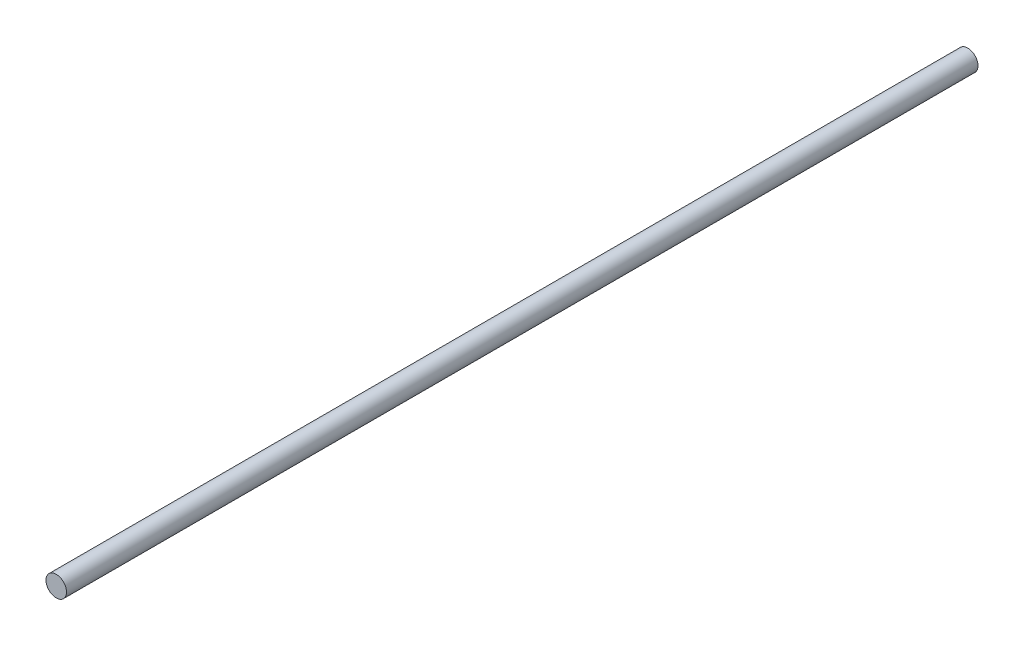
from build123d import *

# Parameters (mm, degrees)
SKETCH1_R           = 0.3937008
BOSS_EXTRUDE4_DEPTH = 35


with BuildPart() as part:
    # Sketch1 → Boss-Extrude4 (new body)
    with BuildSketch(Plane.XY):
        Circle(SKETCH1_R)
    extrude(amount=BOSS_EXTRUDE4_DEPTH)


solid = part.part
